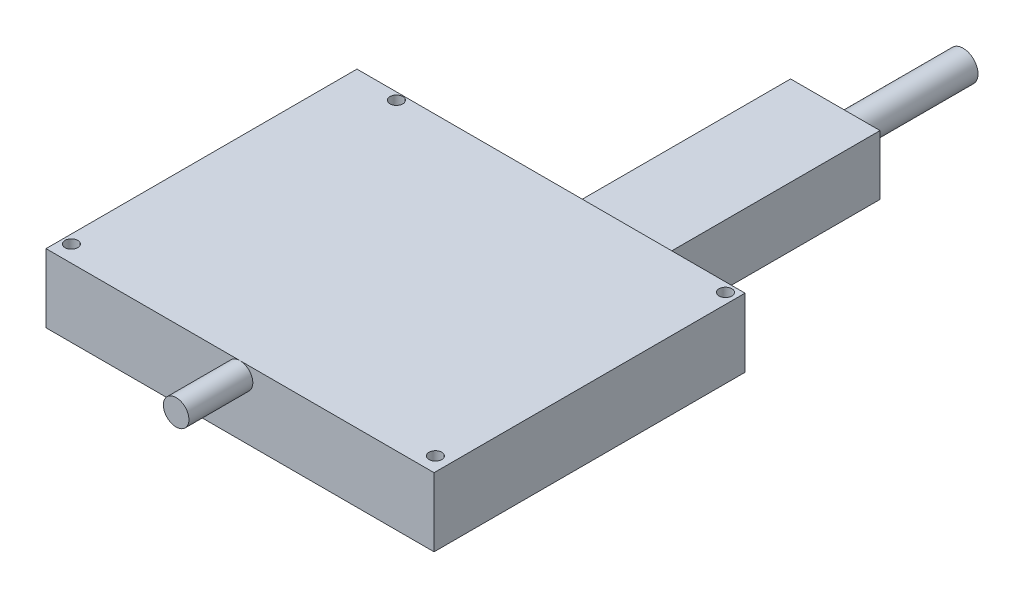
from build123d import *

# Parameters (mm, degrees)
SKETCH1_W                = 91.1
SKETCH1_H                = 73
SKETCH1_R                = 1.5
BOSS_EXTRUDE1_DEPTH      = 16.1
SKETCH2_R                = 3
BOSS_EXTRUDE2_DEPTH      = 15
BOSS_EXTRUDE3_DEPTH      = 12
BOSS_EXTRUDE3_DEPTH_BACK = 2
SKETCH3_W                = 21
SKETCH3_H                = 53
SKETCH4_R                = 3.5
BOSS_EXTRUDE4_DEPTH      = 30


with BuildPart() as part:
    # Sketch1 → Boss-Extrude1 (new body)
    with BuildSketch(Plane(origin=(0, 0, 0), x_dir=(1, 0, 0), z_dir=(0, 1, 0))):
        Rectangle(SKETCH1_W, SKETCH1_H)
        with Locations(Location((-34.59, 34.8, 0), (0, 0, 270))):
            Circle(SKETCH1_R, mode=Mode.SUBTRACT)
        with Locations(Location((43.1, 34.36, 0), (0, 0, 270))):
            Circle(SKETCH1_R, mode=Mode.SUBTRACT)
        with Locations(Location((42.3, -32.93, 0), (0, 0, 270))):
            Circle(SKETCH1_R, mode=Mode.SUBTRACT)
        with Locations(Location((-43.5, -32.58, 0), (0, 0, 270))):
            Circle(SKETCH1_R, mode=Mode.SUBTRACT)
    extrude(amount=BOSS_EXTRUDE1_DEPTH)

    # Sketch2 → Boss-Extrude2 (add)
    with BuildSketch(Plane.XY.offset(36.5)):
        with Locations(Location((0, 13.1, 0), (0, 0, 90))):
            Circle(SKETCH2_R)
    extrude(amount=BOSS_EXTRUDE2_DEPTH)

    # Sketch3 → Boss-Extrude3 (add, two sides: drawn at the far end of the back side and taken through both)
    with BuildSketch(Plane(origin=(0, 0, 0), x_dir=(1, 0, 0), z_dir=(0, 1, 0)).offset(-BOSS_EXTRUDE3_DEPTH_BACK)):
        with Locations((13.75, 63)):
            Rectangle(SKETCH3_W, SKETCH3_H)
    extrude(amount=BOSS_EXTRUDE3_DEPTH + BOSS_EXTRUDE3_DEPTH_BACK)

    # Sketch4 → Boss-Extrude4 (add)
    with BuildSketch(Plane(origin=(0, 0, -89.5), x_dir=(-1, 0, 0), z_dir=(0, 0, -1))):
        with Locations((-13.75, 5)):
            Circle(SKETCH4_R)
    extrude(amount=BOSS_EXTRUDE4_DEPTH)


solid = part.part
